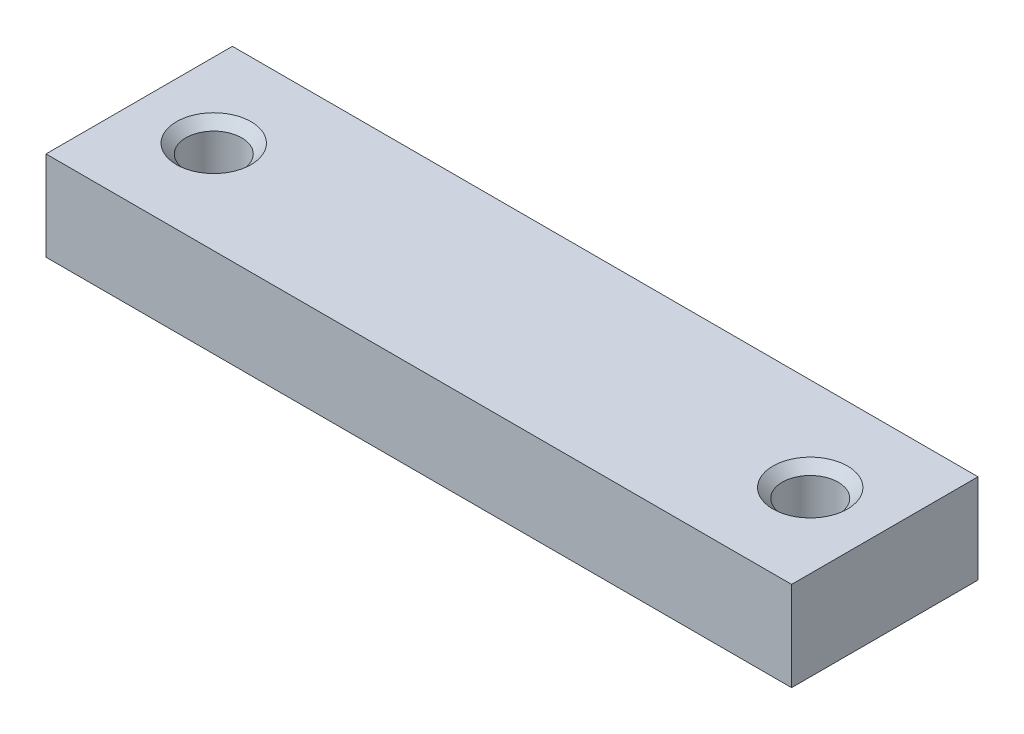
from build123d import *

# Parameters (mm, degrees)
SKETCH_2_W          = 100
SKETCH_2_H          = 25
EXTRUDE_1_DEPTH     = 6
CUT_EXTRUDE_1_REACH = 54.917
SKETCH_3_R          = 3.75
CHAMFER_2_SIZE      = 1.25


with BuildPart() as part:
    # Эскиз2 → Бобышка-Вытянуть1 (new, symmetric)
    with BuildSketch(Plane(origin=(0, 0, 0), x_dir=(1, 0, 0), z_dir=(0, 1, 0))):
        Rectangle(SKETCH_2_W, SKETCH_2_H)
    extrude(amount=EXTRUDE_1_DEPTH, both=True)

    # Эскиз3 → Вырез-Вытянуть1 (cut, up to next)
    with BuildSketch(Plane(origin=(0, 6, 0), x_dir=(1, 0, 0), z_dir=(0, 1, 0)), mode=Mode.PRIVATE) as cut_extrude_1_sk1:
        with Locations(Location((-40, 0, 0), (0, 0, 270))):
            Circle(SKETCH_3_R)
    cut_extrude_1_tool1 = extrude(cut_extrude_1_sk1.sketch, amount=-CUT_EXTRUDE_1_REACH, mode=Mode.PRIVATE) & part.part
    # Эскиз3 → Вырез-Вытянуть1 (cut, up to next)
    with BuildSketch(Plane(origin=(0, 6, 0), x_dir=(1, 0, 0), z_dir=(0, 1, 0)), mode=Mode.PRIVATE) as cut_extrude_1_sk2:
        with Locations(Location((40, 0, 0), (0, 0, 270))):
            Circle(SKETCH_3_R)
    cut_extrude_1_tool2 = extrude(cut_extrude_1_sk2.sketch, amount=-CUT_EXTRUDE_1_REACH, mode=Mode.PRIVATE) & part.part
    add(cut_extrude_1_tool1.solids().sort_by_distance((-40, 6, 0))[0], mode=Mode.SUBTRACT)
    add(cut_extrude_1_tool2.solids().sort_by_distance((40, 6, 0))[0], mode=Mode.SUBTRACT)

    # Фаска2
    chamfer_2_edges = [part.edges().sort_by_distance(p)[0] for p in [
        (-40, 6, -3.75),
        (40, 6, -3.75),
    ]]
    chamfer(chamfer_2_edges, length=CHAMFER_2_SIZE)


solid = part.part
